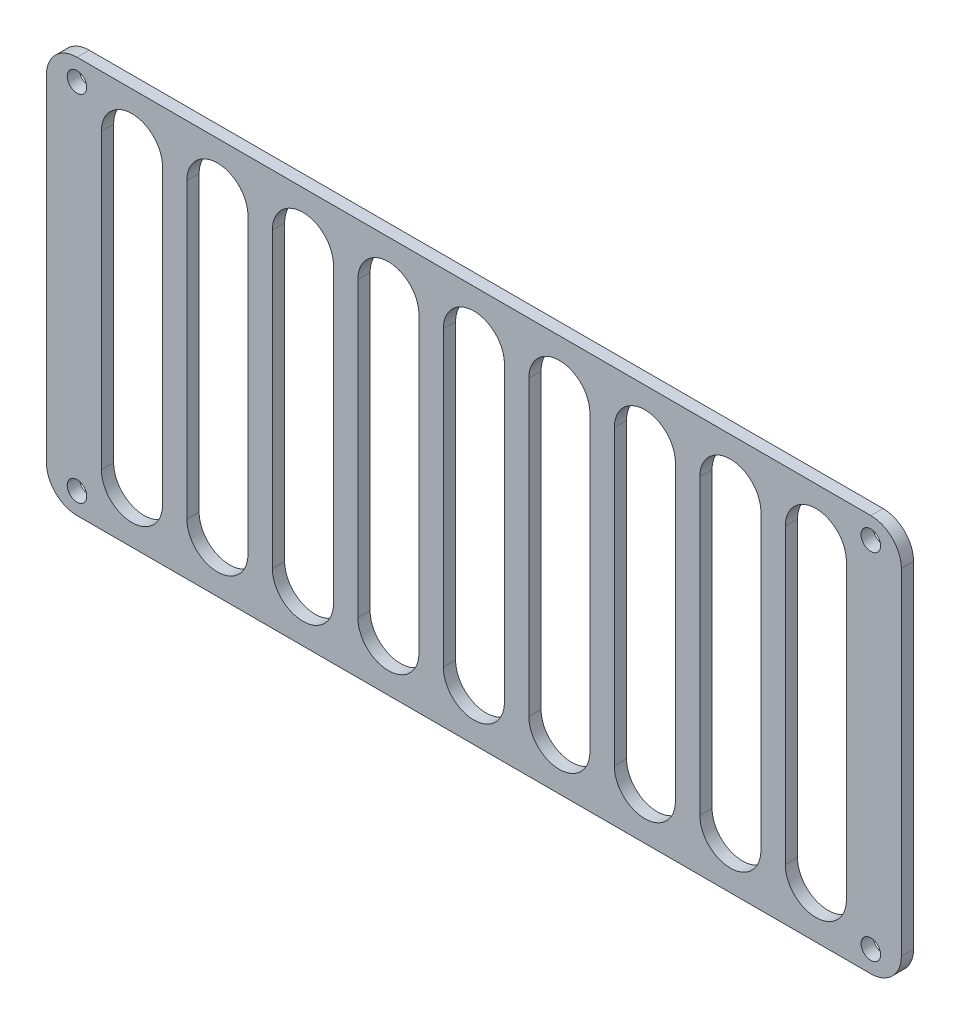
from build123d import *

# Parameters (mm, degrees)
SKETCH_1_W          = 140
SKETCH_1_H          = 65
EXTRUDE_1_DEPTH     = 2
SKETCH_2_R          = 1.6
CUT_EXTRUDE_1_DEPTH = 2
CUT_EXTRUDE_2_DEPTH = 2
FILLET_1_R          = 5


with BuildPart() as part:
    # 草图1 → 凸台-拉伸1 (new body)
    with BuildSketch(Plane.XY):
        Rectangle(SKETCH_1_W, SKETCH_1_H)
    extrude(amount=EXTRUDE_1_DEPTH)

    # 草图2 → 切除-拉伸1 (cut)
    with BuildSketch(Plane.XY.offset(2)):
        with Locations((-65, 29)):
            Circle(SKETCH_2_R)
        with Locations(Location((65, 29, 0), (0, 0, 180))):
            Circle(SKETCH_2_R)
        with Locations((65, -29)):
            Circle(SKETCH_2_R)
        with Locations(Location((-65, -29, 0), (0, 0, 180))):
            Circle(SKETCH_2_R)
    extrude(amount=-CUT_EXTRUDE_1_DEPTH, mode=Mode.SUBTRACT)

    # 草图3 → 切除-拉伸2 (cut)
    with BuildSketch(Plane.XY.offset(2)):
        with BuildLine():
            Line((-51, 24), (-51, -24))
            ThreePointArc((-51, -24), (-56, -29), (-61, -24))
            Line((-61, -24), (-61, 24))
            ThreePointArc((-61, 24), (-56, 29), (-51, 24))
        make_face()
        with BuildLine():
            Line((-37, 24), (-37, -24))
            ThreePointArc((-37, -24), (-42, -29), (-47, -24))
            Line((-47, -24), (-47, 24))
            ThreePointArc((-47, 24), (-42, 29), (-37, 24))
        make_face()
        with BuildLine():
            Line((-23, 24), (-23, -24))
            ThreePointArc((-23, -24), (-28, -29), (-33, -24))
            Line((-33, -24), (-33, 24))
            ThreePointArc((-33, 24), (-28, 29), (-23, 24))
        make_face()
        with BuildLine():
            Line((-9, 24), (-9, -24))
            ThreePointArc((-9, -24), (-14, -29), (-19, -24))
            Line((-19, -24), (-19, 24))
            ThreePointArc((-19, 24), (-14, 29), (-9, 24))
        make_face()
        with BuildLine():
            Line((5, 24), (5, -24))
            ThreePointArc((5, -24), (0, -29), (-5, -24))
            Line((-5, -24), (-5, 24))
            ThreePointArc((-5, 24), (0, 29), (5, 24))
        make_face()
        with BuildLine():
            Line((19, 24), (19, -24))
            ThreePointArc((19, -24), (14, -29), (9, -24))
            Line((9, -24), (9, 24))
            ThreePointArc((9, 24), (14, 29), (19, 24))
        make_face()
        with BuildLine():
            Line((33, 24), (33, -24))
            ThreePointArc((33, -24), (28, -29), (23, -24))
            Line((23, -24), (23, 24))
            ThreePointArc((23, 24), (28, 29), (33, 24))
        make_face()
        with BuildLine():
            Line((47, 24), (47, -24))
            ThreePointArc((47, -24), (42, -29), (37, -24))
            Line((37, -24), (37, 24))
            ThreePointArc((37, 24), (42, 29), (47, 24))
        make_face()
        with BuildLine():
            Line((61, 24), (61, -24))
            ThreePointArc((61, -24), (56, -29), (51, -24))
            Line((51, -24), (51, 24))
            ThreePointArc((51, 24), (56, 29), (61, 24))
        make_face()
    extrude(amount=-CUT_EXTRUDE_2_DEPTH, mode=Mode.SUBTRACT)

    # 圆角1
    fillet_1_edges = [part.edges().sort_by_distance(p)[0] for p in [
        (-70, 32.5, 1),
        (70, 32.5, 1),
        (70, -32.5, 1),
        (-70, -32.5, 1),
    ]]
    fillet(fillet_1_edges, radius=FILLET_1_R)


solid = part.part
